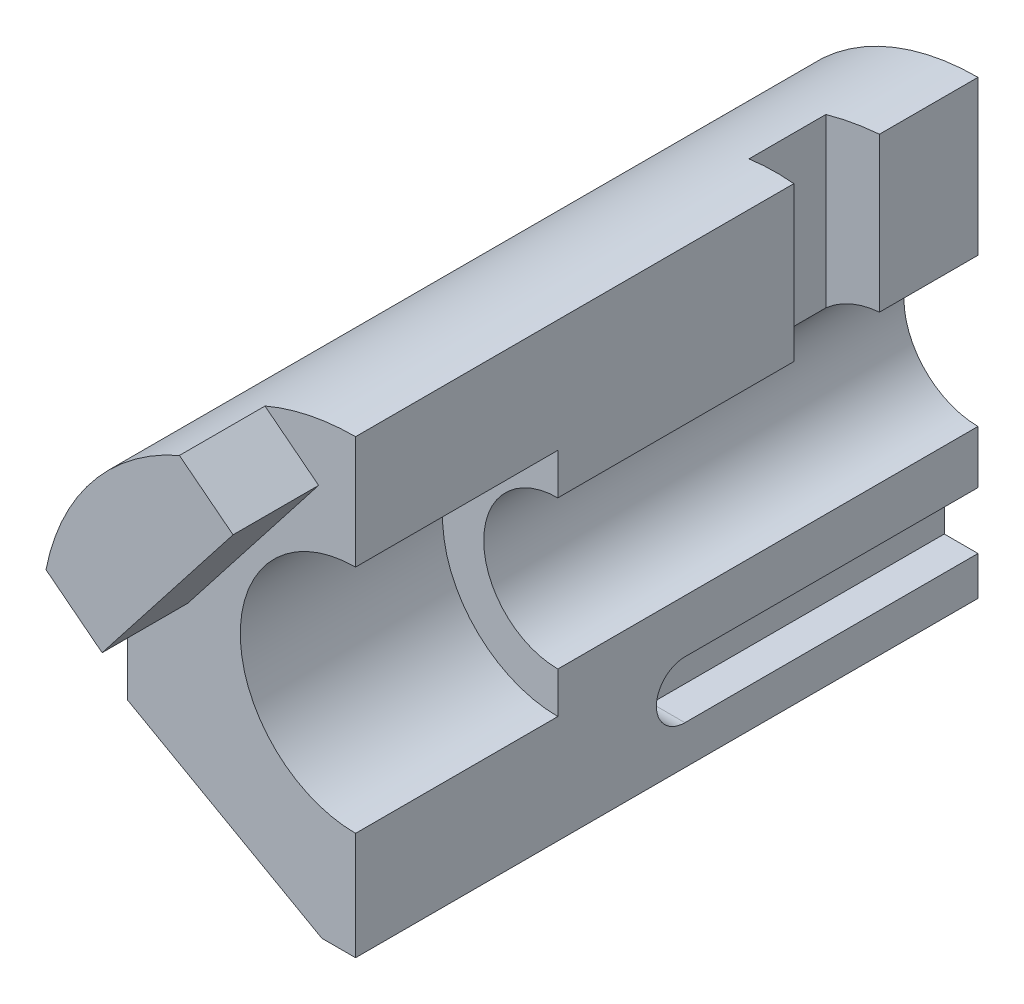
from build123d import *

# Parameters (mm, degrees)
BOSS_EXTRU_1_DEPTH      = 240
ESQUISSE2_R             = 44.45
ENL_V_MAT_EXTRU_1_DEPTH = 78
ESQUISSE3_R             = 28.575
ENL_V_MAT_EXTRU_2_DEPTH = 205.284115878
BOSS_EXTRU_4_DEPTH      = 33
ESQUISSE8_W             = 33
ESQUISSE8_H             = 90
ENL_V_MAT_EXTRU_4_DEPTH = 19
ENL_V_MAT_EXTRU_4_DRAFT = -5
ENL_V_MAT_EXTRU_5_DEPTH = 13


with BuildPart() as part:
    # Esquisse1 → Boss.-Extru.1 (new body)
    with BuildSketch(Plane.XY):
        with BuildLine():
            Line((0, -86), (0, 88))
            ThreePointArc((0, 88), (-62.225396744, 62.225396744), (-88, 0))
            Line((-88, 0), (-88, -43.853430349))
            Line((-88, -43.853430349), (-13, -86))
            Line((-13, -86), (0, -86))
        make_face()
    extrude(amount=BOSS_EXTRU_1_DEPTH)

    # Esquisse2 → Enlèv. mat.-Extru.1 (cut)
    with BuildSketch(Plane.XY.offset(240)):
        Circle(ESQUISSE2_R)
    extrude(amount=-ENL_V_MAT_EXTRU_1_DEPTH, mode=Mode.SUBTRACT)

    # Esquisse3 → Enlèv. mat.-Extru.2 (cut, through all)
    with BuildSketch(Plane.XY.offset(162)):
        Circle(ESQUISSE3_R)
    extrude(amount=-ENL_V_MAT_EXTRU_2_DEPTH, mode=Mode.SUBTRACT)

    # Esquisse7 → Boss.-Extru.4 (add)
    with BuildSketch(Plane.XY.offset(240)):
        with BuildLine():
            Line((-64.719928969, 0), (-40.188548434, 31.398735242))
            Line((-40.188548434, 31.398735242), (-14.235687992, 64.616881796))
            Line((-14.235687992, 64.616881796), (-34.918120487, 80.775769025))
            ThreePointArc((-34.918120487, 80.775769025), (-68.534051615, 55.20039646), (-86.360508015, 16.907473358))
            Line((-86.360508015, 16.907473358), (-64.719928969, 0))
        make_face()
    extrude(amount=BOSS_EXTRU_4_DEPTH)


with BuildPart() as enl_v_mat_extru_4_tool:
    # Esquisse8 → Enlèv. mat.-Extru.4 (with draft: the straight prism first)
    with BuildSketch(Plane(origin=(0, 0, 0), x_dir=(0, 0, -1), z_dir=(1, 0, 0))):
        with Locations((-54.5, 49.335999727)):
            Rectangle(ESQUISSE8_W, ESQUISSE8_H)
    extrude(amount=-ENL_V_MAT_EXTRU_4_DEPTH)
    # Enlèv. mat.-Extru.4: the draft: its side faces are tilted about the plane it starts from
    enl_v_mat_extru_4_sides = [enl_v_mat_extru_4_tool.faces().sort_by_distance(p)[0] for p in [
        (-9.5, 49.335999727, 71),
        (-9.5, 4.335999727, 54.5),
        (-9.5, 49.335999727, 38),
        (-9.5, 94.335999727, 54.5),
    ]]
    draft(enl_v_mat_extru_4_sides, Plane(origin=(0, 0, 0), x_dir=(0, 0, -1), z_dir=(1, 0, 0)), ENL_V_MAT_EXTRU_4_DRAFT)


with BuildPart() as part_1:
    add(part.part)

    # Enlèv. mat.-Extru.4: cut by enl_v_mat_extru_4_tool
    add(enl_v_mat_extru_4_tool.part, mode=Mode.SUBTRACT)

    # Esquisse9 → Enlèv. mat.-Extru.5 (cut)
    with BuildSketch(Plane(origin=(0, 0, 0), x_dir=(0, 0, -1), z_dir=(1, 0, 0))):
        with BuildLine():
            Line((-113, -49), (0, -49))
            Line((0, -49), (0, -71))
            Line((0, -71), (-113, -71))
            ThreePointArc((-113, -71), (-124, -60), (-113, -49))
        make_face()
    extrude(amount=-ENL_V_MAT_EXTRU_5_DEPTH, mode=Mode.SUBTRACT)


solid = part_1.part
